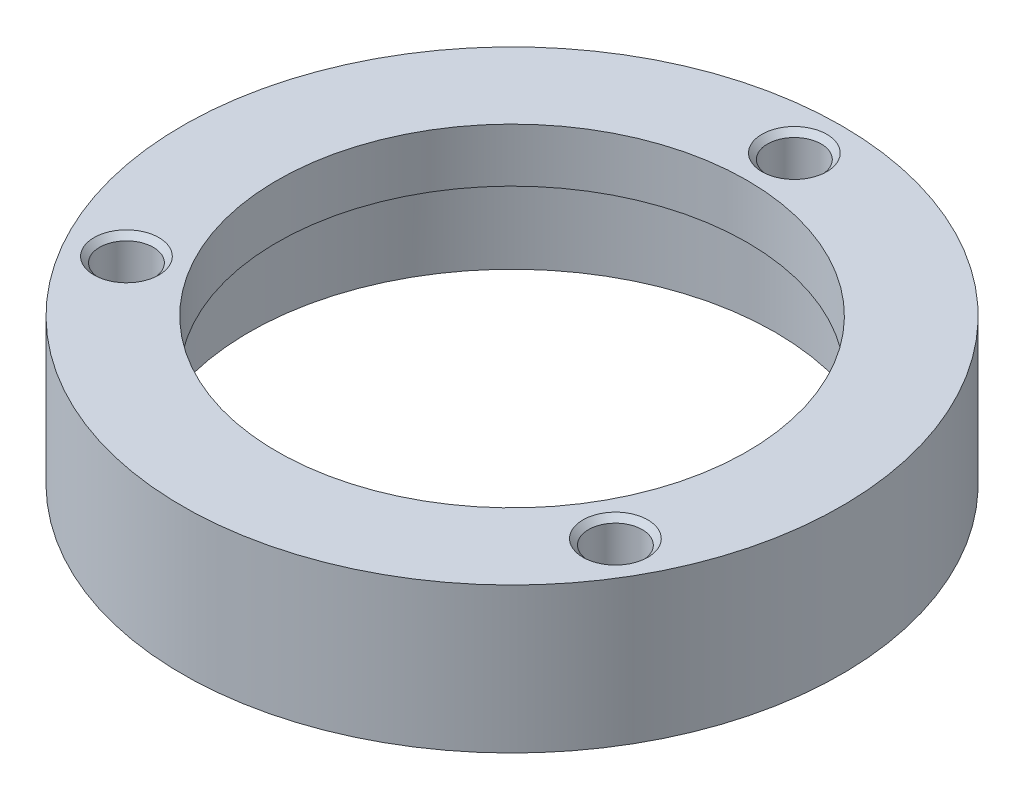
from build123d import *

# Parameters (mm, degrees)
SKETCH1_R           = 29.45
SKETCH1_R_2         = 21
BOSS_EXTRUDE1_DEPTH = 13
SKETCH2_R           = 2.4
CUT_EXTRUDE1_DEPTH  = 4
CHAMFER1_SIZE       = 0.5
SKETCH4_R           = 23.5
CUT_EXTRUDE2_DEPTH  = 8.2


with BuildPart() as part:
    # Sketch1 → Boss-Extrude1 (new body)
    with BuildSketch(Plane(origin=(0, 0, 0), x_dir=(1, 0, 0), z_dir=(0, 1, 0))):
        with Locations(Location((0, 0, 0), (0, 0, 90))):
            Circle(SKETCH1_R)
        with Locations(Location((0, 0, 0), (0, 0, 90))):
            Circle(SKETCH1_R_2, mode=Mode.SUBTRACT)
    extrude(amount=BOSS_EXTRUDE1_DEPTH)

    # Sketch2 → Cut-Extrude1 (cut)
    with BuildSketch(Plane(origin=(0, 13, 0), x_dir=(1, 0, 0), z_dir=(0, 1, 0))):
        with Locations(Location((0, 25.225, 0), (0, 0, 270))):
            Circle(SKETCH2_R)
        with Locations(Location((21.84549081, -12.6125, 0), (0, 0, 270))):
            Circle(SKETCH2_R)
        with Locations(Location((-21.84549081, -12.6125, 0), (0, 0, 270))):
            Circle(SKETCH2_R)
    extrude(amount=-CUT_EXTRUDE1_DEPTH, mode=Mode.SUBTRACT)

    # Chamfer1
    chamfer1_edges = [part.edges().sort_by_distance(p)[0] for p in [
        (0, 13, -27.625),
        (21.84549081, 13, 10.2125),
        (-21.84549081, 13, 10.2125),
    ]]
    chamfer(chamfer1_edges, length=CHAMFER1_SIZE)

    # Sketch4 → Cut-Extrude2 (cut)
    with BuildSketch(Plane.XZ):
        with Locations(Location((0, 0, 0), (0, 0, 270))):
            Circle(SKETCH4_R)
    extrude(amount=-CUT_EXTRUDE2_DEPTH, mode=Mode.SUBTRACT)


solid = part.part
